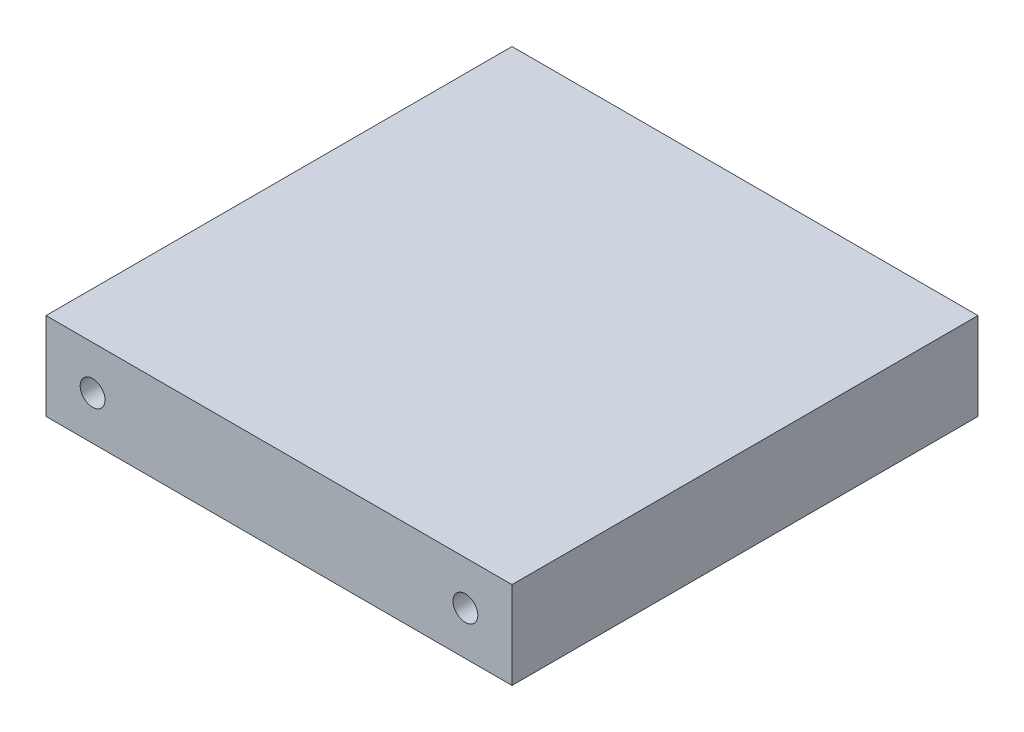
from build123d import *

# Parameters (mm, degrees)
SKETCH2_W                 = 50.8
SKETCH2_H                 = 50.8
BOSS_EXTRUDE1_DEPTH       = 9.525
F_6_32_TAPPED_HOLE1_D     = 2.7051
F_6_32_TAPPED_HOLE1_DEPTH = 9.398
F_6_32_TAPPED_HOLE1_TIP   = 0.81269403
F_6_32_TAPPED_HOLE2_D     = 2.7051
F_6_32_TAPPED_HOLE2_DEPTH = 9.398
F_6_32_TAPPED_HOLE2_TIP   = 0.81269403


with BuildPart() as part:
    # Sketch2 → Boss-Extrude1 (new body)
    with BuildSketch(Plane(origin=(0, 0, 0), x_dir=(1, 0, 0), z_dir=(0, 1, 0))):
        Rectangle(SKETCH2_W, SKETCH2_H)
    extrude(amount=BOSS_EXTRUDE1_DEPTH)

    # #6-32 Tapped Hole1
    with Locations(Plane.XY.offset(25.4)):
        with Locations((-20.32, 4.7625), (20.32, 4.7625)):
            Hole(F_6_32_TAPPED_HOLE1_D / 2, depth=F_6_32_TAPPED_HOLE1_DEPTH)
            with Locations((0, 0, -(F_6_32_TAPPED_HOLE1_DEPTH + F_6_32_TAPPED_HOLE1_TIP / 2))):  # 118° drill point
                Cone(0, F_6_32_TAPPED_HOLE1_D / 2, F_6_32_TAPPED_HOLE1_TIP, mode=Mode.SUBTRACT)

    # #6-32 Tapped Hole2
    with Locations(Plane(origin=(0, 0, -25.4), x_dir=(-1, 0, 0), z_dir=(0, 0, -1))):
        with Locations((-20.32, 4.7625), (20.32, 4.7625)):
            Hole(F_6_32_TAPPED_HOLE2_D / 2, depth=F_6_32_TAPPED_HOLE2_DEPTH)
            with Locations((0, 0, -(F_6_32_TAPPED_HOLE2_DEPTH + F_6_32_TAPPED_HOLE2_TIP / 2))):  # 118° drill point
                Cone(0, F_6_32_TAPPED_HOLE2_D / 2, F_6_32_TAPPED_HOLE2_TIP, mode=Mode.SUBTRACT)


solid = part.part
